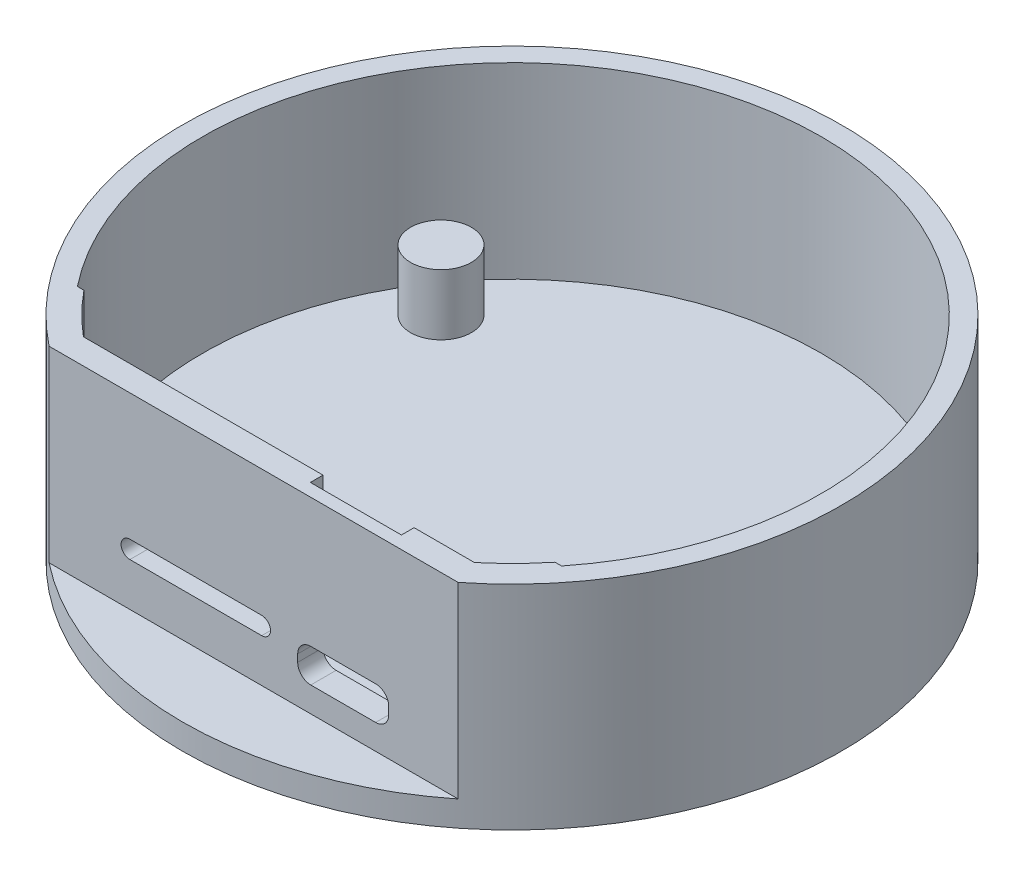
from build123d import *
from build123d.topology import SkipClean

# Parameters (mm, degrees)
SKETCH1_R           = 32.5
BOSS_EXTRUDE1_DEPTH = 21
SHELL1_T            = -2.5
CUT_EXTRUDE2_START  = -18.5
CUT_EXTRUDE2_DEPTH  = 18.5
BOSS_EXTRUDE2_DEPTH = 18.5
CUT_EXTRUDE4_DEPTH  = 18.5
SKETCH9_R           = 3
BOSS_EXTRUDE3_DEPTH = 6
CUT_EXTRUDE3_REACH  = 71.707
SKETCH8_W           = 8.98
SKETCH8_H           = 14.74
CUT_EXTRUDE5_DEPTH  = 1.25


with BuildPart() as part:
    # Sketch1 → Boss-Extrude1 (new body)
    with BuildSketch(Plane(origin=(0, 0, 0), x_dir=(1, 0, 0), z_dir=(0, 1, 0))):
        with Locations(Location((0, 0, 0), (0, 0, 90))):
            Circle(SKETCH1_R)
    extrude(amount=BOSS_EXTRUDE1_DEPTH)

    # Shell1
    shell1_openings = [part.faces().sort_by_distance(p)[0] for p in [
        (0, 21, 0),
    ]]
    offset(amount=SHELL1_T, openings=shell1_openings, kind=Kind.INTERSECTION)

    # Sketch4 → Cut-Extrude2 (cut)
    with BuildSketch(Plane(origin=(0, 21, 0), x_dir=(1, 0, 0), z_dir=(0, 1, 0)).offset(CUT_EXTRUDE2_START)):
        with BuildLine():
            Line((-19.2835, -22.981440942), (19.2835, -22.981440942))
            Line((19.2835, -22.981440942), (22.980499826, -22.981440942))
            ThreePointArc((22.980499826, -22.981440942), (0, -32.5), (-22.980499826, -22.981440942))
            Line((-22.980499826, -22.981440942), (-19.2835, -22.981440942))
        make_face()
    extrude(amount=CUT_EXTRUDE2_DEPTH, mode=Mode.SUBTRACT)

    # Sketch5 → Boss-Extrude2 (add, through all)
    with SkipClean():  # the faces are left unmerged after this step: merging them gives an invalid solid
        with BuildSketch(Plane(origin=(0, 2.5, 0), x_dir=(1, 0, 0), z_dir=(0, 1, 0))):
            with BuildLine():
                Line((-22.980499826, -22.981440942), (22.980499826, -22.981440942))
                ThreePointArc((22.980499826, -22.981440942), (21.612881002, -24.27206985), (20.17290677, -25.481440942))
                Line((20.17290677, -25.481440942), (-20.17290677, -25.481440942))
                ThreePointArc((-20.17290677, -25.481440942), (-21.612881002, -24.27206985), (-22.980499826, -22.981440942))
            make_face()
        extrude(amount=BOSS_EXTRUDE2_DEPTH)

    # Sketch7 → Cut-Extrude4 (cut)
    with SkipClean():  # the faces are left unmerged after this step: merging them gives an invalid solid
        with BuildSketch(Plane(origin=(0, 21, 0), x_dir=(1, 0, 0), z_dir=(0, 1, 0))):
            with BuildLine():
                Line((-23.231549664, -18.981440942), (-23.873728234, -18.981440942))
                ThreePointArc((-23.873728234, -18.981440942), (0, 30.5), (23.873728234, -18.981440942))
                Line((23.873728234, -18.981440942), (23.231549664, -18.981440942))
                Line((23.231549664, -18.981440942), (-23.231549664, -18.981440942))
            make_face()
        extrude(amount=-CUT_EXTRUDE4_DEPTH, mode=Mode.SUBTRACT)

    # Sketch9 → Boss-Extrude3 (add)
    with SkipClean():  # the faces are left unmerged after this step: merging them gives an invalid solid
        with BuildSketch(Plane(origin=(0, 2.5, 0), x_dir=(1, 0, 0), z_dir=(0, 1, 0))):
            with Locations(Location((-22, 15, 0), (0, 0, 270))):
                Circle(SKETCH9_R)
            with Locations(Location((22, 15, 0), (0, 0, 270))):
                Circle(SKETCH9_R)
            with Locations(Location((-17, -19, 0), (0, 0, 270))):
                Circle(SKETCH9_R)
        extrude(amount=BOSS_EXTRUDE3_DEPTH)

    # Sketch6 → Cut-Extrude3 (cut, up to next)
    with BuildSketch(Plane.XY.offset(25.481440942), mode=Mode.PRIVATE) as cut_extrude3_sk1:
        with BuildLine():
            Line((-12.2, 8.5), (0.8, 8.5))
            ThreePointArc((0.8, 8.5), (1.667712103, 7.632287897), (0.8, 6.764575794))
            Line((0.8, 6.764575794), (-12.2, 6.764575794))
            ThreePointArc((-12.2, 6.764575794), (-13.067712103, 7.632287897), (-12.2, 8.5))
        make_face()
    cut_extrude3_tool1 = extrude(cut_extrude3_sk1.sketch, amount=-CUT_EXTRUDE3_REACH, mode=Mode.PRIVATE) & part.part
    # Sketch6 → Cut-Extrude3 (cut, up to next)
    with BuildSketch(Plane.XY.offset(25.481440942), mode=Mode.PRIVATE) as cut_extrude3_sk2:
        with BuildLine():
            Line((5.64, 4.97), (12.04, 4.97))
            ThreePointArc((12.04, 4.97), (12.952167748, 5.347832252), (13.33, 6.26))
            Line((13.33, 6.26), (13.33, 6.98))
            ThreePointArc((13.33, 6.98), (12.952167748, 7.892167748), (12.04, 8.27))
            Line((12.04, 8.27), (5.64, 8.27))
            ThreePointArc((5.64, 8.27), (4.727832252, 7.892167748), (4.35, 6.98))
            Line((4.35, 6.98), (4.35, 6.26))
            ThreePointArc((4.35, 6.26), (4.727832252, 5.347832252), (5.64, 4.97))
        make_face()
    cut_extrude3_tool2 = extrude(cut_extrude3_sk2.sketch, amount=-CUT_EXTRUDE3_REACH, mode=Mode.PRIVATE) & part.part
    add(cut_extrude3_tool1.solids().sort_by_distance((-5.7, 7.632288, 25.481441))[0], mode=Mode.SUBTRACT)
    add(cut_extrude3_tool2.solids().sort_by_distance((8.84, 6.62, 25.481441))[0], mode=Mode.SUBTRACT)

    # Sketch8 → Cut-Extrude5 (cut)
    with SkipClean():  # the faces are left unmerged after this step: merging them gives an invalid solid
        with BuildSketch(Plane(origin=(0, 0, 22.981440942), x_dir=(-1, 0, 0), z_dir=(0, 0, -1))):
            with Locations((-8.84, 13.63)):
                Rectangle(SKETCH8_W, SKETCH8_H)
        extrude(amount=-CUT_EXTRUDE5_DEPTH, mode=Mode.SUBTRACT)


solid = part.part
